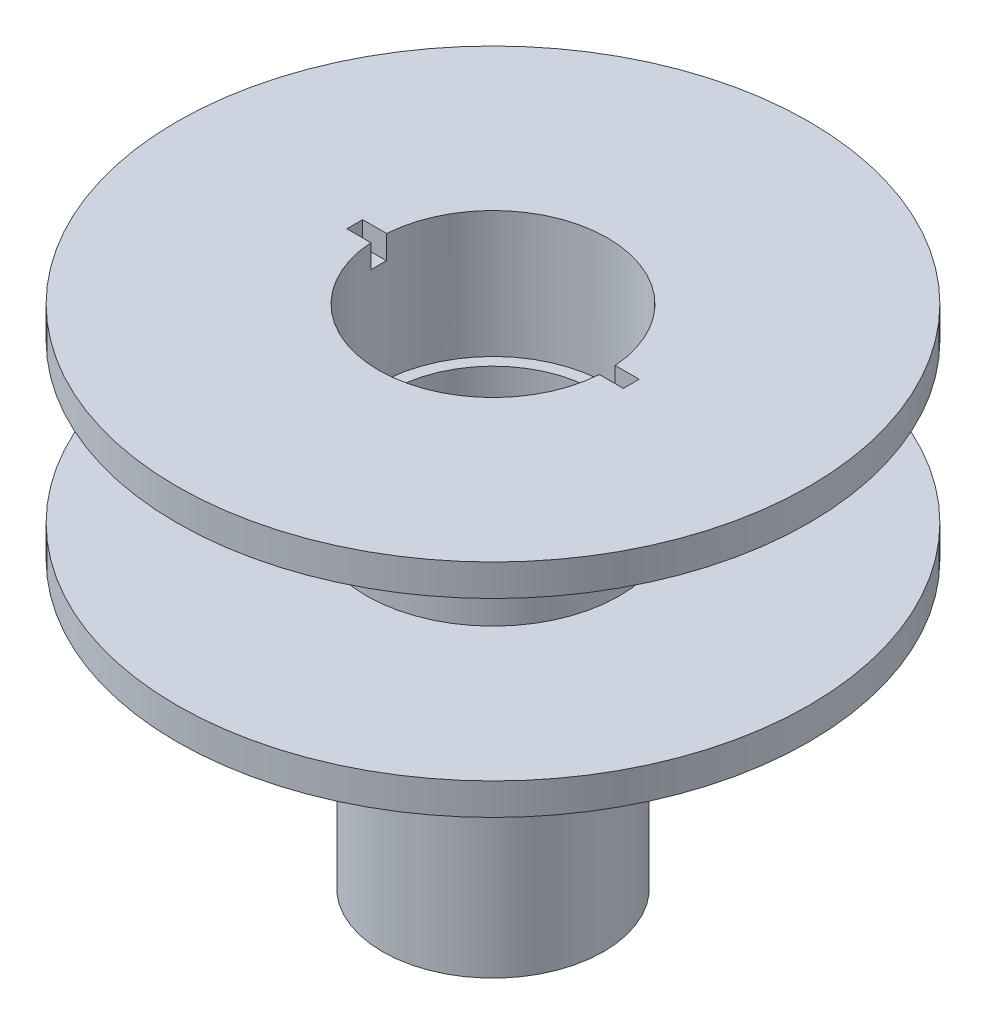
from build123d import *

# Parameters (mm, degrees)
CUT_EXTRUDE1_START = 66
SKETCH2_R          = 14.5
CUT_EXTRUDE1_DEPTH = 66
SKETCH3_W          = 35
SKETCH3_H          = 2
CUT_EXTRUDE2_DEPTH = 3


with BuildPart() as part:
    # Sketch1 → Revolve1 (revolve)
    with BuildSketch(Plane(origin=(0, 0, 0), x_dir=(0, 0, -1), z_dir=(1, 0, 0))):
        Polygon((-16, 3.37389395), (-40, 3.37389395), (-40, -0.62610605), (-14.5, -0.62610605), (-14, -0.62610605), (-14, -36.62610605), (-13, -36.62610605), (-13, -0.62610605), (-13, 11.37389395), (-14.5, 11.37389395), (-14.5, 23.37389395), (-16, 23.37389395), align=None)
    revolve1 = revolve(axis=Axis((0, 28.058626224, 0), (0, -1, 0)))

    # Mirror3: Revolve1 across plane
    add(revolve1.mirror(Plane.ZX.offset(13.37389395)))

    # Sketch2 → Cut-Extrude1 (cut)
    with BuildSketch(Plane(origin=(0, 11.37389395, 0), x_dir=(1, 0, 0), z_dir=(0, 1, 0)).offset(CUT_EXTRUDE1_START)):
        with Locations(Location((0, 0, 0), (0, 0, 270))):
            Circle(SKETCH2_R)
    extrude(amount=-CUT_EXTRUDE1_DEPTH, mode=Mode.SUBTRACT)

    # Sketch3 → Cut-Extrude2 (cut)
    with BuildSketch(Plane(origin=(0, 27.37389395, 0), x_dir=(1, 0, 0), z_dir=(0, 1, 0))):
        Rectangle(SKETCH3_W, SKETCH3_H)
    extrude(amount=-CUT_EXTRUDE2_DEPTH, mode=Mode.SUBTRACT)


solid = part.part
